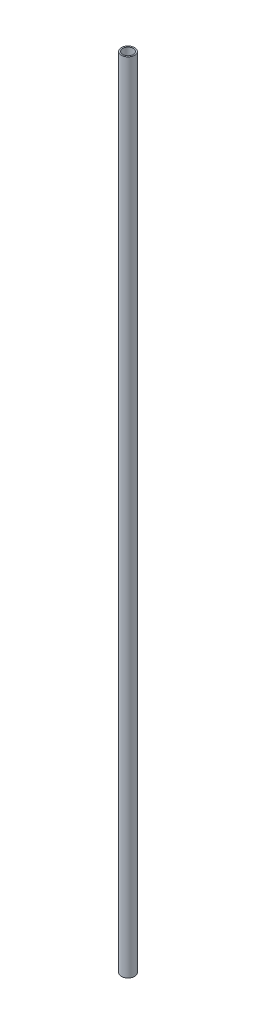
from build123d import *

# Parameters (mm, degrees)
SKETCH1_R           = 5
SKETCH1_R_2         = 4
BOSS_EXTRUDE1_DEPTH = 600


with BuildPart() as part:
    # Sketch1 → Boss-Extrude1 (new body)
    with BuildSketch(Plane(origin=(0, 0, 0), x_dir=(1, 0, 0), z_dir=(0, 1, 0))):
        with Locations(Location((0, 0, 0), (0, 0, 270))):
            Circle(SKETCH1_R)
        with Locations(Location((0, 0, 0), (0, 0, 270))):
            Circle(SKETCH1_R_2, mode=Mode.SUBTRACT)
    extrude(amount=BOSS_EXTRUDE1_DEPTH)


solid = part.part
